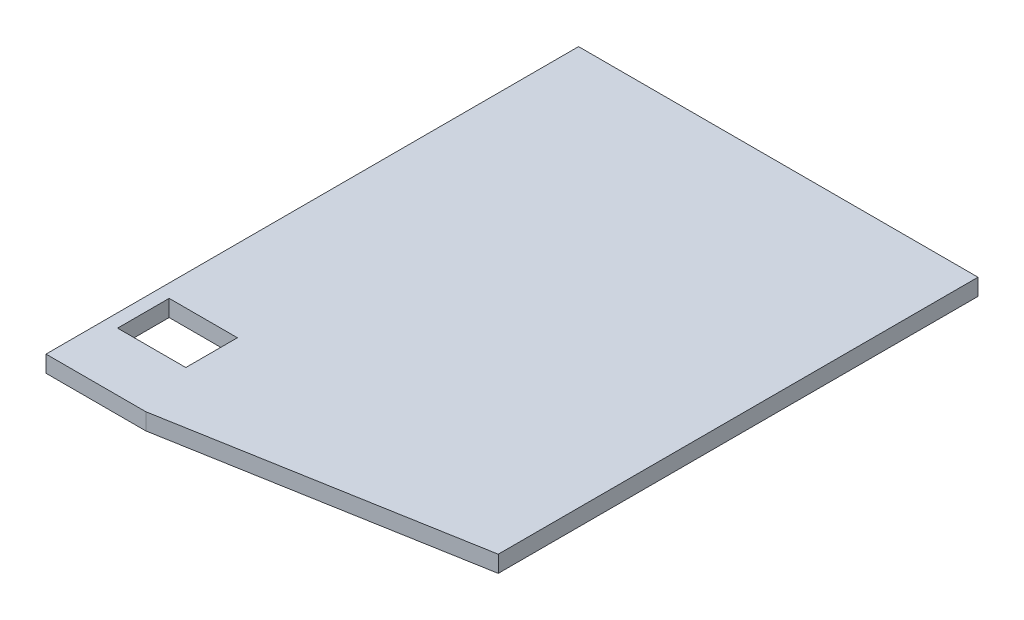
from build123d import *

# Parameters (mm, degrees)
SKETCH_3_W          = 2.5
SKETCH_3_H          = 24
EXTRUDE_1_DEPTH     = 33
FILLET_1_R          = 1
CUT_EXTRUDE_1_DEPTH = 41.880924647
SKETCH_5_W          = 2.5
SKETCH_5_H          = 3.1
CUT_EXTRUDE_2_DEPTH = 4.9
SKETCH_6_W          = 24
SKETCH_6_H          = 2.5
CUT_EXTRUDE_3_DEPTH = 1
CUT_EXTRUDE_4_DEPTH = 41.078048855
SKETCH_8_W          = 0.8
SKETCH_8_H          = 3.1
EXTRUDE_2_DEPTH     = 2.5
SKETCH_10_W         = 4.1
SKETCH_10_H         = 3.1
CUT_EXTRUDE_5_DEPTH = 41.028115119


with BuildPart() as part:
    # 草图3 → 凸台-拉伸1 (new body)
    with BuildSketch(Plane(origin=(0, 0, 0), x_dir=(0, 1, 0), z_dir=(0, 0, 1))):
        with Locations((1.25, -12)):
            Rectangle(SKETCH_3_W, SKETCH_3_H)
    extrude(amount=EXTRUDE_1_DEPTH)

    # 圆角1
    fillet_1_edges = [part.edges().sort_by_distance(p)[0] for p in [
        (24, 2.5, 16.5),
    ]]
    fillet(fillet_1_edges, radius=FILLET_1_R)

    # 草图4 → 切除-拉伸1 (cut, through all)
    with BuildSketch(Plane.XZ):
        Polygon((3, 33), (24, 31.162738066), (24, 33), align=None)
    extrude(amount=-CUT_EXTRUDE_1_DEPTH, mode=Mode.SUBTRACT)

    # 草图5 → 切除-拉伸2 (cut)
    with BuildSketch(Plane(origin=(0, 0, 0), x_dir=(0, -1, 0), z_dir=(-1, 0, 0))):
        with Locations((-1.25, 26.95)):
            Rectangle(SKETCH_5_W, SKETCH_5_H)
    extrude(amount=-CUT_EXTRUDE_2_DEPTH, mode=Mode.SUBTRACT)

    # 草图6 → 切除-拉伸3 (cut)
    with BuildSketch(Plane.XY.offset(33)):
        with Locations((12, 1.25)):
            Rectangle(SKETCH_6_W, SKETCH_6_H)
    extrude(amount=-CUT_EXTRUDE_3_DEPTH, mode=Mode.SUBTRACT)

    # 草图7 → 切除-拉伸4 (cut, through all)
    with BuildSketch(Plane.XZ):
        Polygon((24, 31.162738066), (24, 28.826114347), (6, 32), (14.430052303, 32), align=None)
    extrude(amount=-CUT_EXTRUDE_4_DEPTH, mode=Mode.SUBTRACT)

    # 草图8 → 凸台-拉伸2 (add)
    with BuildSketch(Plane(origin=(0, 2.5, 0), x_dir=(-1, 0, 0), z_dir=(0, 1, 0))):
        with Locations((-0.4, 26.95)):
            Rectangle(SKETCH_8_W, SKETCH_8_H)
    extrude(amount=-EXTRUDE_2_DEPTH)

    # 草图10 → 切除-拉伸5 (cut, through all)
    with BuildSketch(Plane(origin=(0, 1, 0), x_dir=(-1, 0, 0), z_dir=(0, -1, 0))):
        Polygon((-6, -32), (0, -32), (0, 0), (-24, 0), (-24, -28.826114347), align=None)
        with Locations((-2.85, -26.95)):
            Rectangle(SKETCH_10_W, SKETCH_10_H, mode=Mode.SUBTRACT)
    extrude(amount=-CUT_EXTRUDE_5_DEPTH, mode=Mode.SUBTRACT)


solid = part.part
